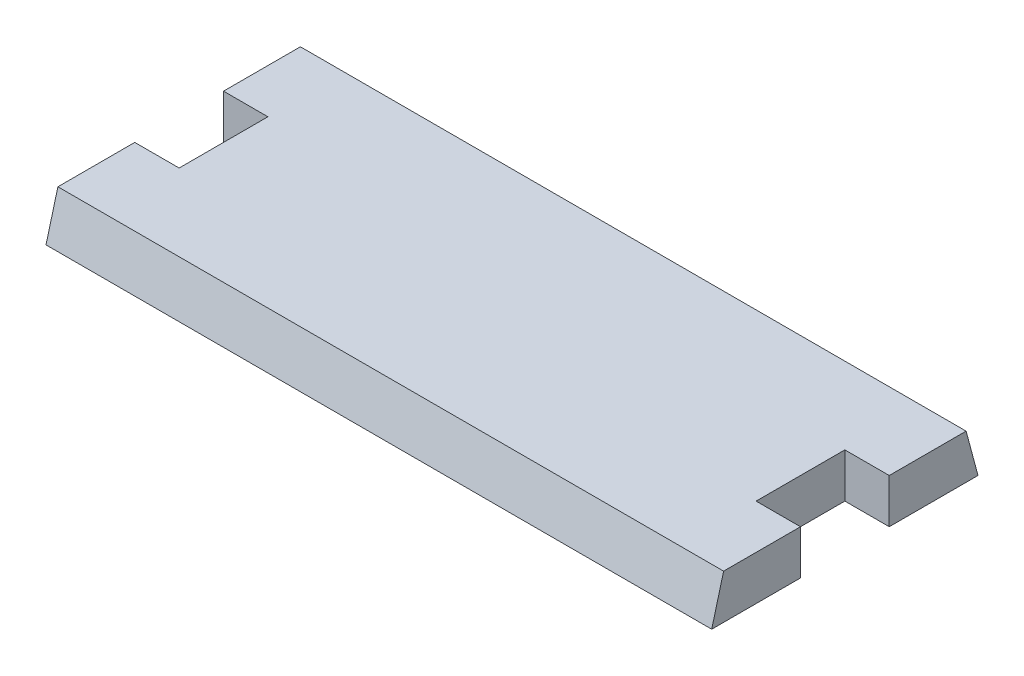
from build123d import *

# Parameters (mm, degrees)
BOSS_EXTRUDE1_DEPTH = 10
DRAFT5_ANGLE        = -15


with BuildPart() as part:
    # Sketch1 → Boss-Extrude1 (new body)
    with BuildSketch(Plane(origin=(0, 0, 0), x_dir=(1, 0, 0), z_dir=(0, 1, 0))):
        Polygon((75, 10), (75, 30), (-75, 30), (-75, 10), (-65, 10), (-65, -10), (-75, -10), (-75, -30), (75, -30), (75, -10), (65, -10), (65, 10), align=None)
    extrude(amount=BOSS_EXTRUDE1_DEPTH)

    # Draft5
    draft5_faces = [part.faces().sort_by_distance(p)[0] for p in [
        (0, 5, -30),
        (0, 5, 30),
    ]]
    draft(draft5_faces, Plane(origin=(0, 0, 0), x_dir=(0, 0, -1), z_dir=(0, -1, 0)), DRAFT5_ANGLE)


solid = part.part
